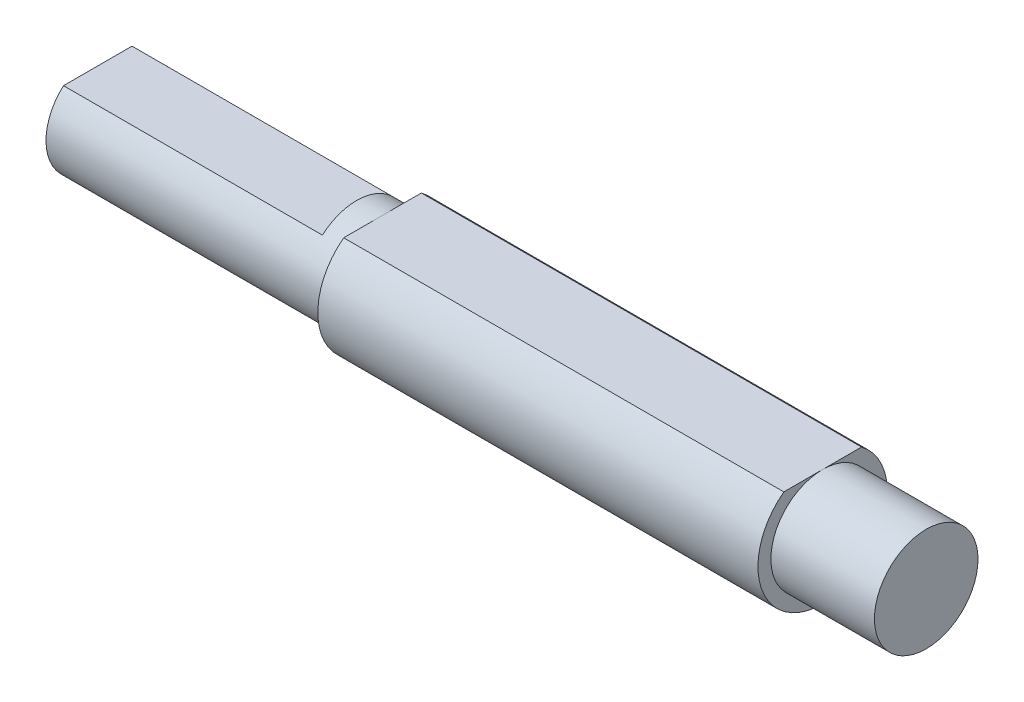
from build123d import *

# Parameters (mm, degrees)
SKETCH1_R             = 2
BOSS_EXTRUDE1_DEPTH   = 4
SKETCH2_R             = 2.5
BOSS_EXTRUDE2_DEPTH   = 17
CUT_EXTRUDE1_START    = -17
CUT_EXTRUDE1_DEPTH    = 17
SKETCH4_R             = 2
BOSS_EXTRUDE3_DEPTH   = 11
BODY_MOVE_COPY3_ANGLE = 90
BODY_MOVE_COPY5_ANGLE = 90
CUT_EXTRUDE2_START    = -10
CUT_EXTRUDE2_DEPTH    = 10


with BuildPart() as part:
    # Sketch1 → Boss-Extrude1 (new body)
    with BuildSketch(Plane(origin=(0, 0, 0), x_dir=(1, 0, 0), z_dir=(0, 1, 0))):
        with Locations(Location((0, 0, 0), (0, 0, 270))):
            Circle(SKETCH1_R)
    extrude(amount=BOSS_EXTRUDE1_DEPTH)

    # Sketch2 → Boss-Extrude2 (add)
    with BuildSketch(Plane(origin=(0, 4, 0), x_dir=(1, 0, 0), z_dir=(0, 1, 0))):
        with Locations(Location((0, 0, 0), (0, 0, 270))):
            Circle(SKETCH2_R)
    extrude(amount=BOSS_EXTRUDE2_DEPTH)

    # Sketch3 → Cut-Extrude1 (cut)
    with BuildSketch(Plane(origin=(0, 21, 0), x_dir=(1, 0, 0), z_dir=(0, 1, 0)).offset(CUT_EXTRUDE1_START)):
        with BuildLine():
            Line((1.5, 2), (-1.5, 2))
            ThreePointArc((-1.5, 2), (0, 2.5), (1.5, 2))
        make_face()
    extrude(amount=CUT_EXTRUDE1_DEPTH, mode=Mode.SUBTRACT)

    # Sketch4 → Boss-Extrude3 (add)
    with BuildSketch(Plane(origin=(0, 21, 0), x_dir=(1, 0, 0), z_dir=(0, 1, 0))):
        with Locations(Location((0, 0, 0), (0, 0, 90))):
            Circle(SKETCH4_R)
    extrude(amount=BOSS_EXTRUDE3_DEPTH)


with BuildPart() as part_1:
    # Body-Move/Copy3: moved
    add(part.part.rotate(Axis((0, 15.5, 0), (0, 0, 1)), BODY_MOVE_COPY3_ANGLE))


with BuildPart() as part_2:
    # Body-Move/Copy5: moved
    add(part_1.part.rotate(Axis((0, 15.5, 0.25), (1, 0, 0)), BODY_MOVE_COPY5_ANGLE))

    # Sketch5 → Cut-Extrude2 (cut)
    with BuildSketch(Plane.ZY.offset(16.5).offset(CUT_EXTRUDE2_START)):
        with BuildLine():
            Line((-1.072875656, 17.25), (1.572875656, 17.25))
            ThreePointArc((1.572875656, 17.25), (0.25, 17.75), (-1.072875656, 17.25))
        make_face()
    extrude(amount=CUT_EXTRUDE2_DEPTH, mode=Mode.SUBTRACT)


solid = part_2.part
